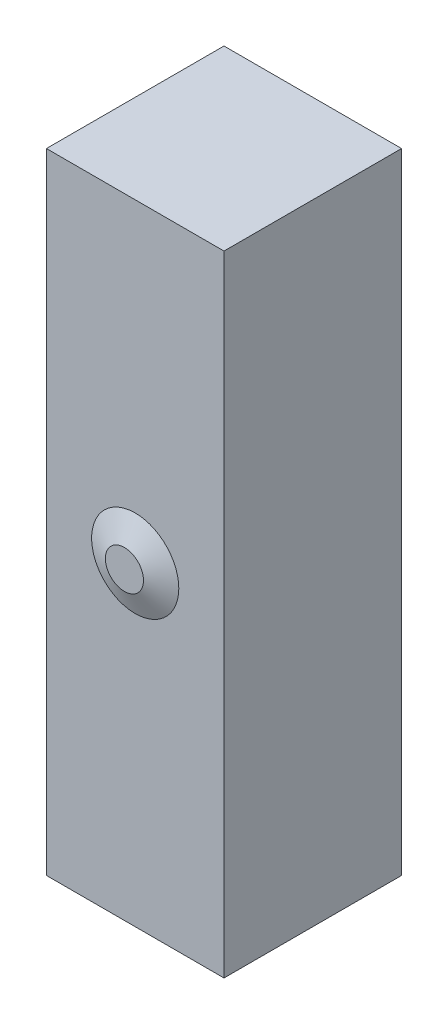
from build123d import *

# Parameters (mm, degrees)
SKETCH1_W           = 16.5
SKETCH1_H           = 58.5
BOSS_EXTRUDE1_DEPTH = 16.5
SKETCH4_R           = 1.77
BOSS_EXTRUDE6_DEPTH = 1
SKETCH4_16_R        = 4.05


with BuildPart() as part:
    # Sketch1 → Boss-Extrude1 (new body)
    with BuildSketch(Plane.XY):
        Rectangle(SKETCH1_W, SKETCH1_H)
    extrude(amount=BOSS_EXTRUDE1_DEPTH)

    # Sketch4 → Boss-Extrude6 (add)
    with BuildSketch(Plane.XY.offset(16.5)):
        Circle(SKETCH4_R)
    extrude(amount=BOSS_EXTRUDE6_DEPTH)

    # Sketch4<16> → section 0 of loft3
    with BuildSketch(Plane.XY.offset(16.5), mode=Mode.PRIVATE) as loft3_s0:
        Circle(SKETCH4_16_R)
    # loft up to a face of the part (loft3)
    loft([loft3_s0.sketch, Face(Wire([part.edges().sort_by_distance((-1.211648377, 1.290274471, 17.5))[0]]))])


solid = part.part
